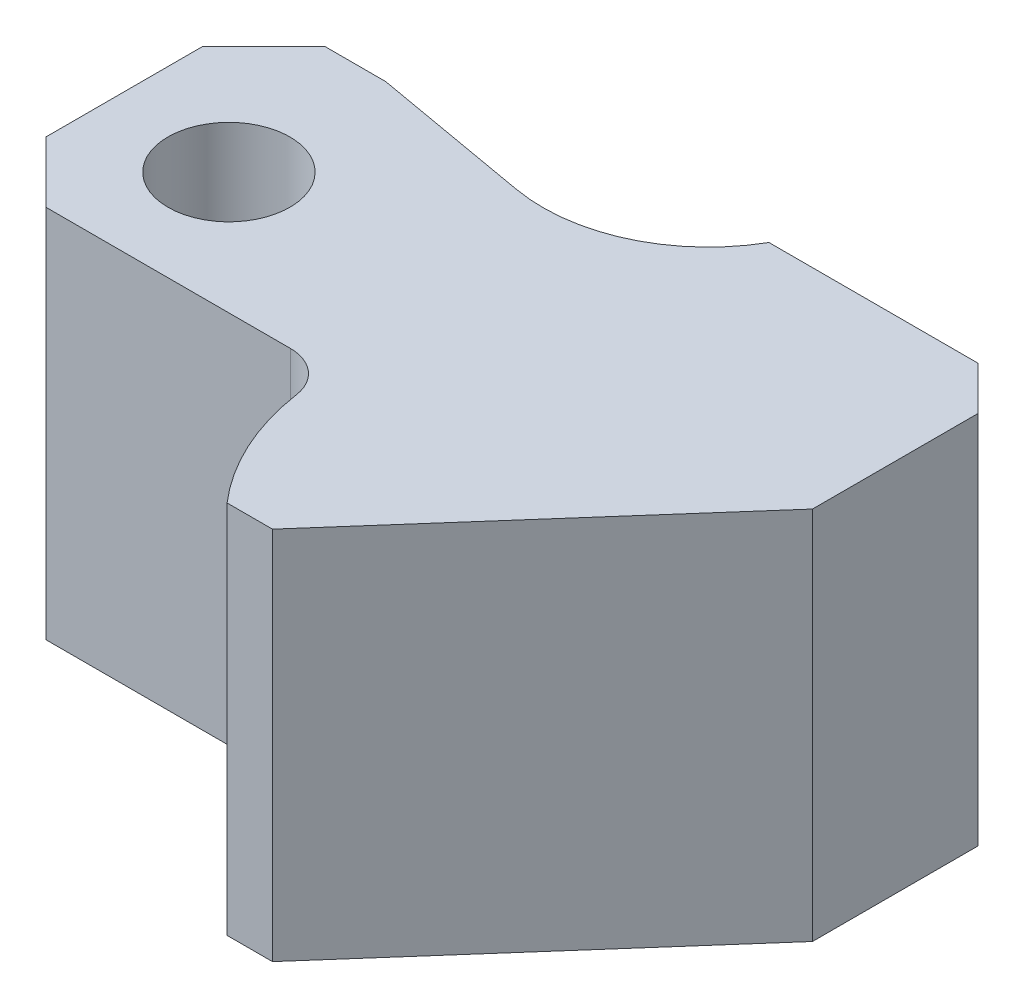
from build123d import *

# Parameters (mm, degrees)
SKETCH2_R           = 7
BOSS_EXTRUDE2_DEPTH = 21.5


with BuildPart() as part:
    # Sketch2 → Boss-Extrude2 (new, symmetric)
    with BuildSketch(Plane(origin=(0, 0, 0), x_dir=(1, 0, 0), z_dir=(0, 1, 0))):
        with BuildLine():
            Line((-7, 18), (0, 18))
            Line((0, 18), (18.243084988, 14.783251905))
            ThreePointArc((18.243084988, 14.783251905), (29.574972961, 16.276069151), (38, 24))
            Line((38, 24), (62, 24))
            Line((62, 24), (67, 19))
            Line((67, 19), (67, 0))
            Line((67, 0), (38, -33))
            Line((38, -33), (32.788067397, -33))
            ThreePointArc((32.788067397, -33), (28.3490952, -26.115672061), (26.012264997, -18.264705882))
            ThreePointArc((26.012264997, -18.264705882), (24.331862036, -15.213413768), (21.066626255, -14))
            Line((21.066626255, -14), (-7, -14))
            Line((-7, -14), (-14, -7))
            Line((-14, -7), (-14, 11))
            Line((-14, 11), (-7, 18))
        make_face()
        with Locations(Location((0, 0, 0), (0, 0, 270))):
            Circle(SKETCH2_R, mode=Mode.SUBTRACT)
    extrude(amount=BOSS_EXTRUDE2_DEPTH, both=True)


solid = part.part
